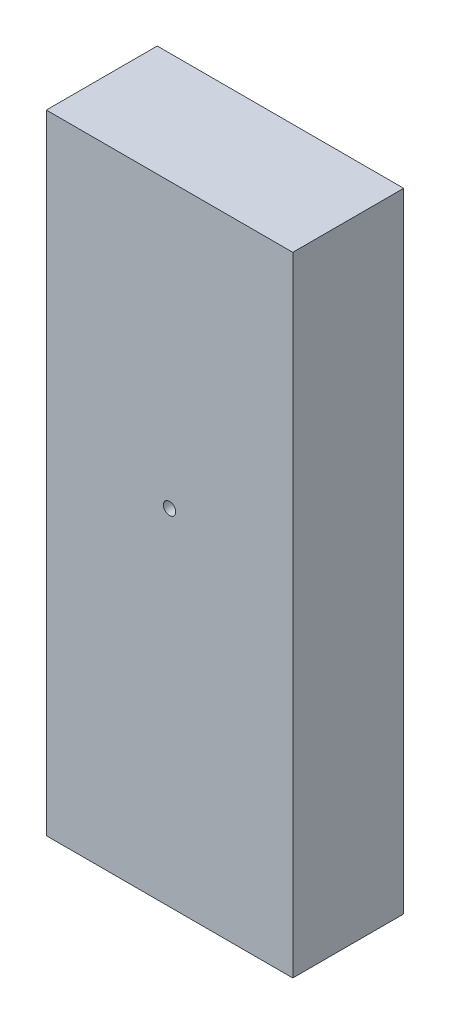
from build123d import *

# Parameters (mm, degrees)
ESQUISSE1_W      = 20
ESQUISSE1_H      = 51
EXTRUSION1_DEPTH = 9
EXTRUSION2_REACH = 51.414
ESQUISSE2_R      = 0.5


with BuildPart() as part:
    # Esquisse1 → Extrusion1 (new body)
    with BuildSketch(Plane.XY):
        with Locations((-5.903123543, -20.411538462)):
            Rectangle(ESQUISSE1_W, ESQUISSE1_H)
    extrude(amount=EXTRUSION1_DEPTH)

    # Esquisse2 → Extrusion2 (cut, up to next)
    with BuildSketch(Plane.XY.offset(9), mode=Mode.PRIVATE) as extrusion2_sk1:
        with Locations((-5.903123543, -17.911538462)):
            Circle(ESQUISSE2_R)
    extrusion2_tool1 = extrude(extrusion2_sk1.sketch, amount=-EXTRUSION2_REACH, mode=Mode.PRIVATE) & part.part
    add(extrusion2_tool1.solids().sort_by_distance((-5.903124, -17.911538, 9))[0], mode=Mode.SUBTRACT)


solid = part.part
